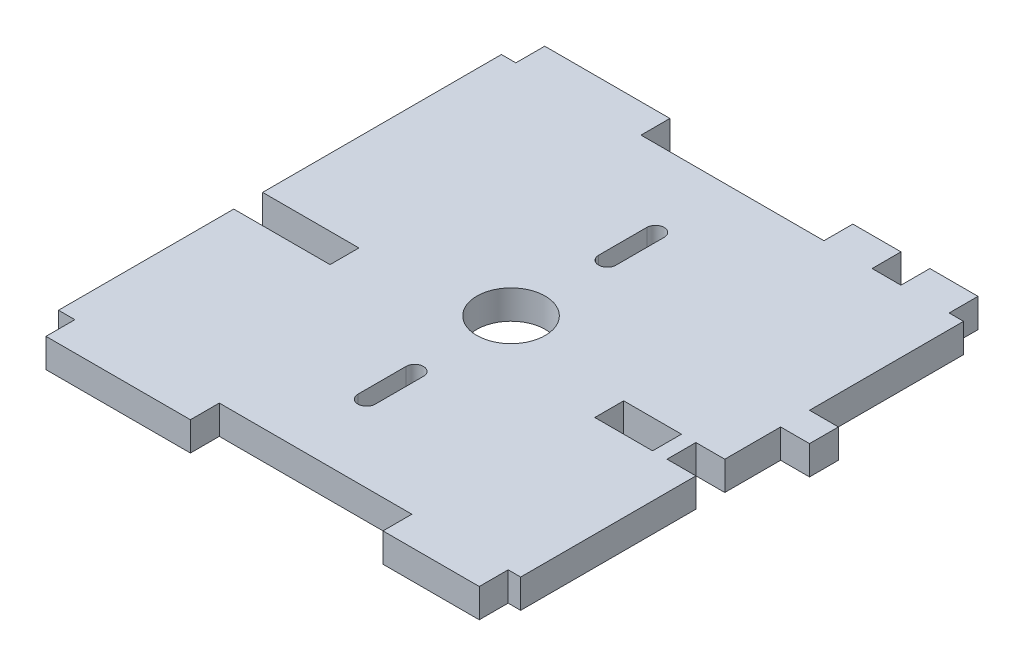
from build123d import *

# Parameters (mm, degrees)
ESBO_O1_W                = 48
ESBO_O1_H                = 46
RESSALTO_EXTRUS_O1_DEPTH = 3
ESBO_O6_W                = 3
ESBO_O6_H                = 3
RESSALTO_EXTRUS_O4_DEPTH = 3
ESBO_O2_R                = 3.55
CORTE_EXTRUS_O1_DEPTH    = 36.594943461
CORTE_EXTRUS_O2_DEPTH    = 36.594943461
PADR_OCIRCULAR1_COUNT    = 2
ESBO_O4_W                = 10
ESBO_O4_H                = 3
ESBO_O4_W_2              = 15
RESSALTO_EXTRUS_O2_DEPTH = 3
ESBO_O5_W                = 5
ESBO_O5_H                = 3
ESBO_O5_W_2              = 13
RESSALTO_EXTRUS_O3_DEPTH = 3
ESBO_O7_W                = 3
ESBO_O7_H                = 3
ESBO_O7_W_2              = 6
ESBO_O7_W_3              = 10
CORTE_EXTRUS_O3_DEPTH    = 38.603191354


with BuildPart() as part:
    # Esboço1 → Ressalto-extrusão1 (new body)
    with BuildSketch(Plane(origin=(0, 0, 0), x_dir=(1, 0, 0), z_dir=(0, 1, 0))):
        Rectangle(ESBO_O1_W, ESBO_O1_H)
    extrude(amount=RESSALTO_EXTRUS_O1_DEPTH)

    # Esboço6 → Ressalto-extrusão4 (add, through all)
    with BuildSketch(Plane(origin=(0, 0, 0), x_dir=(1, 0, 0), z_dir=(0, 1, 0))):
        with Locations((25.5, 5.5)):
            Rectangle(ESBO_O6_W, ESBO_O6_H)
    extrude(amount=RESSALTO_EXTRUS_O4_DEPTH)

    # Esboço2 → Corte-extrusão1 (cut, through all)
    with BuildSketch(Plane(origin=(0, 0, 0), x_dir=(1, 0, 0), z_dir=(0, 1, 0))):
        with Locations(Location((0, 0, 0), (0, 0, 270))):
            Circle(ESBO_O2_R)
    extrude(amount=CORTE_EXTRUS_O1_DEPTH, mode=Mode.SUBTRACT)

    # Esboço3 → Corte-extrusão2 (cut, through all)
    with BuildSketch(Plane(origin=(0, 0, 0), x_dir=(1, 0, 0), z_dir=(0, 1, 0))):
        with BuildLine():
            Line((-0.9, 10), (-0.9, 15))
            ThreePointArc((-0.9, 15), (0, 15.9), (0.9, 15))
            Line((0.9, 15), (0.9, 10))
            ThreePointArc((0.9, 10), (0, 9.1), (-0.9, 10))
        make_face()
    corte_extrus_o2 = extrude(amount=CORTE_EXTRUS_O2_DEPTH, mode=Mode.SUBTRACT)

    # PadrãoCircular1: Corte-extrusão2 ×2 about axis
    padr_ocircular1_axis = Axis((0, 0, 0), (0, 1, 0))
    for i in range(1, PADR_OCIRCULAR1_COUNT):
        add(corte_extrus_o2.rotate(padr_ocircular1_axis, i * 360 / PADR_OCIRCULAR1_COUNT), mode=Mode.SUBTRACT)

    # Esboço4 → Ressalto-extrusão2 (add, through all)
    with BuildSketch(Plane(origin=(0, 3, 0), x_dir=(1, 0, 0), z_dir=(0, 1, 0))):
        with Locations((17.7, -24.5)):
            Rectangle(ESBO_O4_W, ESBO_O4_H)
        with Locations((-14.8, -24.5)):
            Rectangle(ESBO_O4_W_2, ESBO_O4_H)
    extrude(amount=-RESSALTO_EXTRUS_O2_DEPTH)

    # Esboço5 → Ressalto-extrusão3 (add, through all)
    with BuildSketch(Plane(origin=(0, 0, 0), x_dir=(1, 0, 0), z_dir=(0, 1, 0))):
        with Locations((20, 24.5)):
            Rectangle(ESBO_O5_W, ESBO_O5_H)
        with Locations((12, 24.5)):
            Rectangle(ESBO_O5_W, ESBO_O5_H)
        with Locations((-16, 24.5)):
            Rectangle(ESBO_O5_W_2, ESBO_O5_H)
    extrude(amount=RESSALTO_EXTRUS_O3_DEPTH)

    # Esboço7 → Corte-extrusão3 (cut, through all)
    with BuildSketch(Plane(origin=(0, 0, 0), x_dir=(1, 0, 0), z_dir=(0, 1, 0))):
        with Locations((22.5, -3.3)):
            Rectangle(ESBO_O7_W, ESBO_O7_H)
        with Locations((16.5, -3.3)):
            Rectangle(ESBO_O7_W_2, ESBO_O7_H)
        with Locations((-19, -3.3)):
            Rectangle(ESBO_O7_W_3, ESBO_O7_H)
    extrude(amount=CORTE_EXTRUS_O3_DEPTH, mode=Mode.SUBTRACT)


solid = part.part
